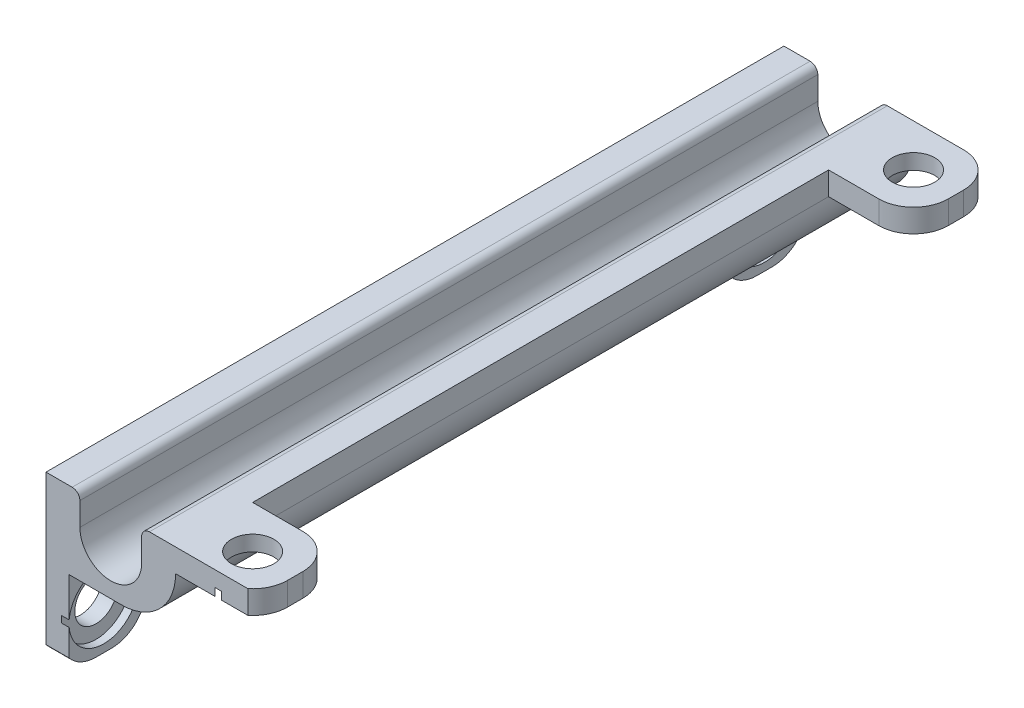
from build123d import *

# Parameters (mm, degrees)
SKETCH1_W                       = 8.390953786
SKETCH1_H                       = 32.6942
SKETCH1_H_2                     = 13
SKETCH1_H_3                     = 2.6
BOSS_EXTRUDE1_DEPTH             = 5
CUT_EXTRUDE1_DEPTH              = 51.767483063
CUT_EXTRUDE1_DEPTH_BACK         = 51.767483063
SKETCH3_W                       = 5.5
SKETCH3_H                       = 5.5
SKETCH3_R                       = 1.375
EXTRUDE_BOTTOM_SCREW_PADS_DEPTH = 1.5
SKETCH4_R                       = 2.25
CUT_BOTTOM_COUNTERSINK_DEPTH    = 0.5
SKETCH5_W                       = 5.5
SKETCH5_H                       = 5.5
SKETCH5_R                       = 1.375
EXTRUDE_SIDE_SCREW_PADS_DEPTH   = 1.5
SKETCH6_R                       = 2.25
CUT_SIDE_COUNTERSINK_DEPTH      = 0.5
FILLET_SCREW_PADS_R             = 2.25
FILLET4_R                       = 3.5
FILLET5_R                       = 0.5
SKETCH7_W                       = 13.890953786
SKETCH7_H                       = 10.5
CUT_EXTRUDE4_DEPTH              = 0.51


with BuildPart() as part:
    # Sketch1 → Boss-Extrude1 (new body)
    with BuildSketch(Plane.XZ.offset(-14.914945084)):
        with Locations((0.553417297, 5.002763775)):
            Rectangle(SKETCH1_W, SKETCH1_H)
        with Locations((0.553417297, 27.849863775)):
            Rectangle(SKETCH1_W, SKETCH1_H_2)
        with Locations((0.553417297, 35.649863775)):
            Rectangle(SKETCH1_W, SKETCH1_H_3)
    extrude(amount=BOSS_EXTRUDE1_DEPTH)

    # Sketch2 → Cut-Extrude1 (cut, two sides: drawn at the far end of the back side and taken through both)
    with BuildSketch(Plane(origin=(0, 0, -11.344336225), x_dir=(-1, 0, 0), z_dir=(0, 0, -1)).offset(-CUT_EXTRUDE1_DEPTH_BACK)):
        with BuildLine():
            Line((-2.553417297, 12.914945084), (-2.553417297, 14.914945084))
            Line((-2.553417297, 14.914945084), (1.446582703, 14.914945084))
            Line((1.446582703, 14.914945084), (1.446582703, 12.914945084))
            ThreePointArc((1.446582703, 12.914945084), (-0.553417297, 10.914945084), (-2.553417297, 12.914945084))
        make_face()
    extrude(amount=CUT_EXTRUDE1_DEPTH + CUT_EXTRUDE1_DEPTH_BACK, mode=Mode.SUBTRACT)

    # Sketch3 → Extrude Bottom Screw Pads (add)
    # profile 1 of 2: a face of its own
    with BuildSketch(Plane(origin=(0, 14.914945084, 0), x_dir=(1, 0, 0), z_dir=(0, 1, 0))):
        with Locations((7.49889419, 8.594336225)):
            Rectangle(SKETCH3_W, SKETCH3_H)
        with Locations(Location((7.49889419, 8.594336225, 0), (0, 0, 180))):
            Circle(SKETCH3_R, mode=Mode.SUBTRACT)
    # profile 2 of 2: a face of its own
    with BuildSketch(Plane(origin=(0, 14.914945084, 0), x_dir=(1, 0, 0), z_dir=(0, 1, 0))):
        with Locations((7.49889419, -34.199863775)):
            Rectangle(SKETCH3_W, SKETCH3_H)
        with Locations(Location((7.49889419, -34.199863775, 0), (0, 0, 180))):
            Circle(SKETCH3_R, mode=Mode.SUBTRACT)
    extrude(amount=-EXTRUDE_BOTTOM_SCREW_PADS_DEPTH)

    # Sketch4 → Cut Bottom Countersink (cut)
    with BuildSketch(Plane.XZ.offset(-13.414945084)):
        with Locations((7.49889419, 34.199863775)):
            Circle(SKETCH4_R)
        with Locations((7.49889419, -8.594336225)):
            Circle(SKETCH4_R)
    extrude(amount=-CUT_BOTTOM_COUNTERSINK_DEPTH, mode=Mode.SUBTRACT)

    # Sketch5 → Extrude Side Screw Pads (add)
    # profile 1 of 2: a face of its own
    with BuildSketch(Plane.ZY.offset(3.642059596)):
        with Locations((-8.594336225, 7.164945084)):
            Rectangle(SKETCH5_W, SKETCH5_H)
        with Locations(Location((-8.594336225, 7.164945084, 0), (0, 0, 270))):
            Circle(SKETCH5_R, mode=Mode.SUBTRACT)
    # profile 2 of 2: a face of its own
    with BuildSketch(Plane.ZY.offset(3.642059596)):
        with Locations((34.199863775, 7.164945084)):
            Rectangle(SKETCH5_W, SKETCH5_H)
        with Locations(Location((34.199863775, 7.164945084, 0), (0, 0, 270))):
            Circle(SKETCH5_R, mode=Mode.SUBTRACT)
    extrude(amount=-EXTRUDE_SIDE_SCREW_PADS_DEPTH)

    # Sketch6 → Cut Side Countersink (cut)
    with BuildSketch(Plane(origin=(-2.142059596, 0, 0), x_dir=(0, 0, -1), z_dir=(1, 0, 0))):
        with Locations(Location((-34.199863775, 7.164945084, 0), (0, 0, 90))):
            Circle(SKETCH6_R)
        with Locations(Location((8.594336225, 7.164945084, 0), (0, 0, 90))):
            Circle(SKETCH6_R)
    extrude(amount=-CUT_SIDE_COUNTERSINK_DEPTH, mode=Mode.SUBTRACT)

    # Fillet Screw Pads
    fillet_screw_pads_edges = [part.edges().sort_by_distance(p)[0] for p in [
        (-2.892059596, 4.414945084, 36.949863775),
        (-2.892059596, 4.414945084, 31.449863775),
        (10.24889419, 14.164945084, -11.344336225),
        (10.24889419, 14.164945084, -5.844336225),
        (10.24889419, 14.164945084, 31.449863775),
        (10.24889419, 14.164945084, 36.949863775),
        (-2.892059596, 4.414945084, -5.844336225),
        (-2.892059596, 4.414945084, -11.344336225),
    ]]
    fillet(fillet_screw_pads_edges, radius=FILLET_SCREW_PADS_R)

    # Fillet4
    fillet4_edges = [part.edges().sort_by_distance(p)[0] for p in [
        (4.74889419, 9.914945084, 12.802763775),
    ]]
    fillet(fillet4_edges, radius=FILLET4_R)

    # Fillet5
    fillet5_edges = [part.edges().sort_by_distance(p)[0] for p in [
        (2.553417297, 14.914945084, 12.802763775),
        (-1.446582703, 14.914945084, 12.802763775),
    ]]
    fillet(fillet5_edges, radius=FILLET5_R)

    # Sketch7 → Cut-Extrude4 (cut)
    with BuildSketch(Plane.XY.offset(36.949863775)):
        with Locations((3.303417297, 9.664945084)):
            Rectangle(SKETCH7_W, SKETCH7_H)
    extrude(amount=-CUT_EXTRUDE4_DEPTH, mode=Mode.SUBTRACT)


solid = part.part
